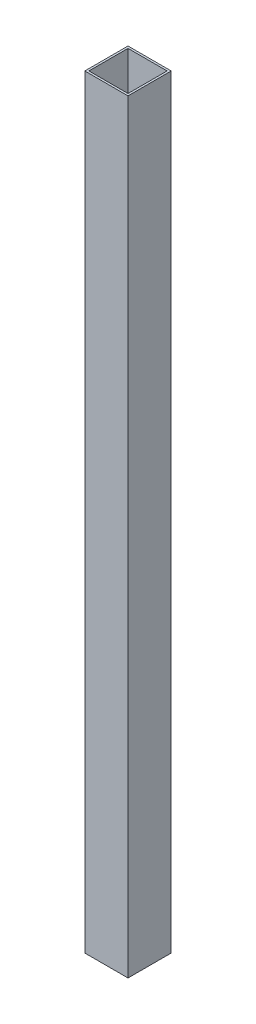
from build123d import *

# Parameters (mm, degrees)
SKETCH2_W           = 25.4
SKETCH2_H           = 25.4
SKETCH2_W_2         = 23
SKETCH2_H_2         = 23
BOSS_EXTRUDE1_DEPTH = 449.2


with BuildPart() as part:
    # Sketch2 → Boss-Extrude1 (new body)
    with BuildSketch(Plane(origin=(0, 0, 0), x_dir=(1, 0, 0), z_dir=(0, 1, 0))):
        Rectangle(SKETCH2_W, SKETCH2_H)
        Rectangle(SKETCH2_W_2, SKETCH2_H_2, mode=Mode.SUBTRACT)
    extrude(amount=BOSS_EXTRUDE1_DEPTH)


solid = part.part
